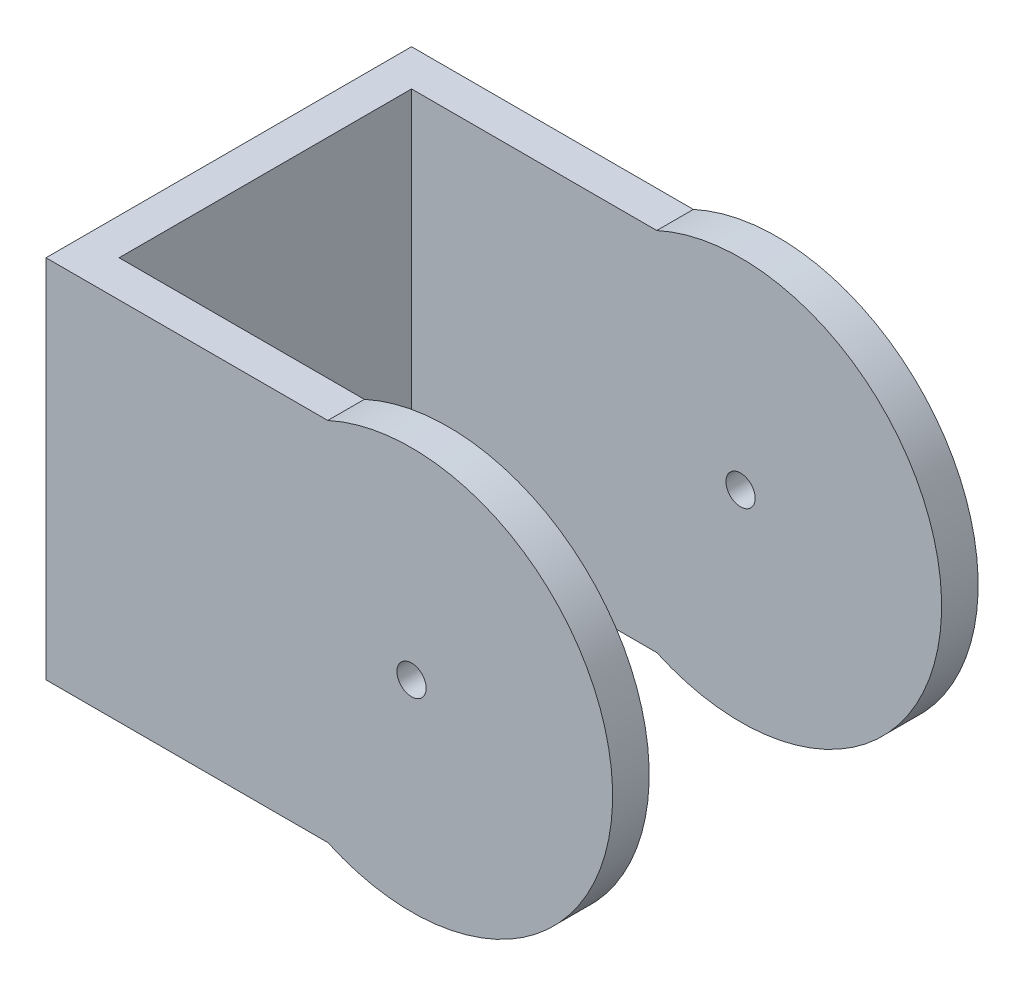
from build123d import *

# Parameters (mm, degrees)
SKETCH1_R           = 0.4
BOSS_EXTRUDE1_DEPTH = 10
SKETCH2_W           = 8
SKETCH2_H           = 15
CUT_EXTRUDE2_DEPTH  = 19
SKETCH3_W           = 10
SKETCH3_H           = 10
BOSS_EXTRUDE2_DEPTH = 1
SKETCH4_R           = 0.4
CUT_EXTRUDE3_DEPTH  = 2


with BuildPart() as part:
    # Sketch1 → Boss-Extrude1 (new body)
    with BuildSketch(Plane.XY):
        with BuildLine():
            Line((-10, 5), (-10, -5))
            Line((-10, -5), (-2.291287847, -5))
            ThreePointArc((-2.291287847, -5), (5.5, 0), (-2.291287847, 5))
            Line((-2.291287847, 5), (-10, 5))
        make_face()
        Circle(SKETCH1_R, mode=Mode.SUBTRACT)
    extrude(amount=BOSS_EXTRUDE1_DEPTH)

    # Sketch2 → Cut-Extrude2 (cut)
    with BuildSketch(Plane.ZY.offset(10)):
        with Locations((5, 0)):
            Rectangle(SKETCH2_W, SKETCH2_H)
    extrude(amount=-CUT_EXTRUDE2_DEPTH, mode=Mode.SUBTRACT)


with BuildPart() as cut_extrude2_piece_1:
    # of the separate pieces the step leaves, piece 1, a body of its own (cut_extrude2_pieces)
    add(part.part.solids().sort_by_distance((-2.291287847, 5, 0))[0])



with BuildPart() as cut_extrude2_piece_2:
    # of the separate pieces the step leaves, piece 2, a body of its own (cut_extrude2_pieces)
    add(part.part.solids().sort_by_distance((-10, 5, 9))[0])


with BuildPart() as cut_extrude2_piece_1_1:
    add(cut_extrude2_piece_1.part)

    add(cut_extrude2_piece_2.part)  # Boss-Extrude2 merges Cut-Extrude2 piece 2
    # Sketch3 → Boss-Extrude2 (add)
    with BuildSketch(Plane.ZY.offset(10)):
        with Locations((5, 0)):
            Rectangle(SKETCH3_W, SKETCH3_H)
    extrude(amount=-BOSS_EXTRUDE2_DEPTH)

    # Sketch4 → Cut-Extrude3 (cut)
    with BuildSketch(Plane.ZY.offset(10)):
        with Locations(Location((5, 0, 0), (0, 0, 270))):
            Circle(SKETCH4_R)
    extrude(amount=-CUT_EXTRUDE3_DEPTH, mode=Mode.SUBTRACT)


solid = cut_extrude2_piece_1_1.part
